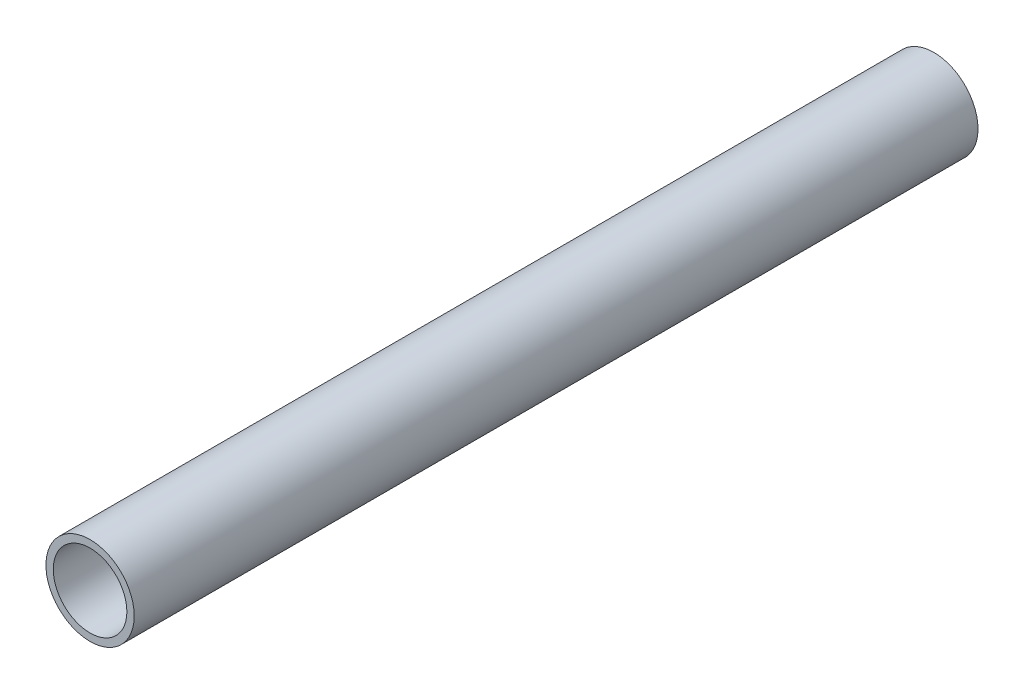
from build123d import *

# Parameters (mm, degrees)
SKETCH1_R           = 9
SKETCH1_R_2         = 7.5
BOSS_EXTRUDE1_DEPTH = 172


with BuildPart() as part:
    # Sketch1 → Boss-Extrude1 (new body)
    with BuildSketch(Plane.XY):
        Circle(SKETCH1_R)
        Circle(SKETCH1_R_2, mode=Mode.SUBTRACT)
    extrude(amount=BOSS_EXTRUDE1_DEPTH)


solid = part.part
